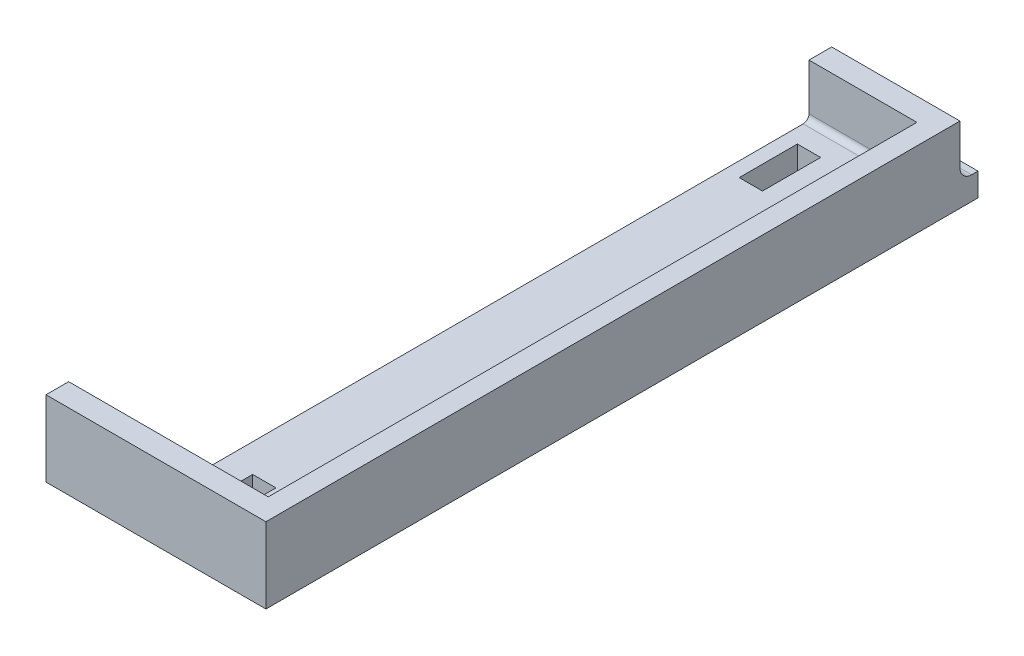
from build123d import *

# Parameters (mm, degrees)
BOSS_EXTRUDE1_DEPTH = 4
BOSS_EXTRUDE3_DEPTH = 9
FILLET2_R           = 2
SKETCH4_W           = 92
SKETCH4_H           = 4
BOSS_EXTRUDE4_DEPTH = 4.75
SKETCH3_W           = 4
SKETCH3_H           = 10
CUT_EXTRUDE1_DEPTH  = 10
FILLET3_R           = 1
SKETCH5_W           = 27.288974613
SKETCH5_H           = 12.039440348
CUT_EXTRUDE2_DEPTH  = 10


with BuildPart() as part:
    # Sketch1 → Boss-Extrude1 (new body)
    with BuildSketch(Plane(origin=(0, 0, 0), x_dir=(1, 0, 0), z_dir=(0, 1, 0))):
        Polygon((0, 0), (0, 3.9), (20.5, 3.9), (20.5, 95.9), (15.75, 95.9), (15.75, 132.4), (20.5, 132.4), (37.8, 132.4), (37.8, 129.4), (37.8, 0), align=None)
    extrude(amount=-BOSS_EXTRUDE1_DEPTH)

    # Sketch2 → Boss-Extrude3 (add)
    with BuildSketch(Plane(origin=(0, 0, 0), x_dir=(1, 0, 0), z_dir=(0, 1, 0))):
        Polygon((0, 3.9), (0, 0), (37.8, 0), (37.8, 119.3), (15.75, 119.3), (15.75, 115.4), (34.3, 115.4), (34.3, 3.9), align=None)
    extrude(amount=BOSS_EXTRUDE3_DEPTH)

    # Fillet2
    fillet2_edges = [part.edges().sort_by_distance(p)[0] for p in [
        (26.775, 0, -119.3),
    ]]
    fillet(fillet2_edges, radius=FILLET2_R)

    # Sketch4 → Boss-Extrude4 (add)
    with BuildSketch(Plane.ZY.offset(-20.5)):
        with Locations((-49.9, -2)):
            Rectangle(SKETCH4_W, SKETCH4_H)
    extrude(amount=BOSS_EXTRUDE4_DEPTH)

    # Sketch3 → Cut-Extrude1 (cut)
    with BuildSketch(Plane(origin=(0, 0, 0), x_dir=(1, 0, 0), z_dir=(0, 1, 0))):
        with Locations((20.25, 105.9)):
            Rectangle(SKETCH3_W, SKETCH3_H)
        Polygon((20.620220413, 14.9), (24.620220413, 14.9), (24.619779587, 4.941884315), (20.619779587, 4.941884315), align=None)
    extrude(amount=-CUT_EXTRUDE1_DEPTH, mode=Mode.SUBTRACT)

    # Fillet3
    fillet3_edges = [part.edges().sort_by_distance(p)[0] for p in [
        (25.025, 0, -3.9),
        (25.025, 0, -115.4),
        (34.3, 0, -59.65),
    ]]
    fillet(fillet3_edges, radius=FILLET3_R)

    # Sketch5 → Cut-Extrude2 (cut)
    with BuildSketch(Plane(origin=(0, 0, -132.4), x_dir=(-1, 0, 0), z_dir=(0, 0, -1))):
        with Locations((-27.50627438, -2.276541586)):
            Rectangle(SKETCH5_W, SKETCH5_H)
    extrude(amount=-CUT_EXTRUDE2_DEPTH, mode=Mode.SUBTRACT)


solid = part.part
